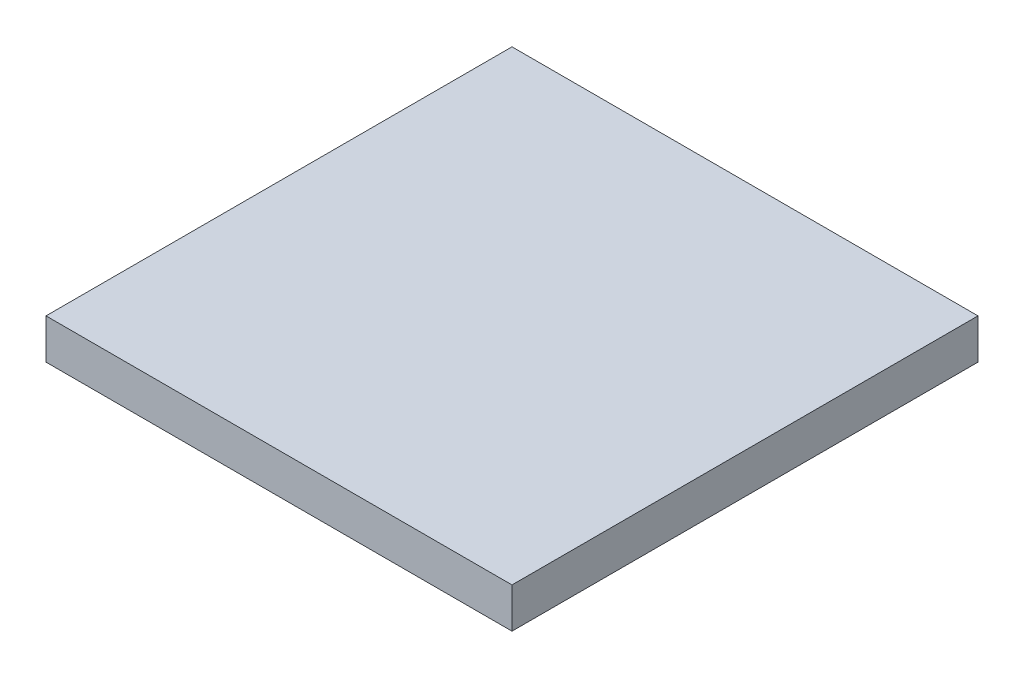
from build123d import *

# Parameters (mm, degrees)
SKIZZE1_W                       = 3000
SKIZZE1_H                       = 3000
AUFSATZ_LINEAR_AUSTRAGEN1_DEPTH = 258


with BuildPart() as part:
    # Skizze1 → Aufsatz-Linear austragen1 (new body)
    with BuildSketch(Plane(origin=(0, 0, 0), x_dir=(1, 0, 0), z_dir=(0, 1, 0))):
        with Locations((455.462294315, -1047.275658361)):
            Rectangle(SKIZZE1_W, SKIZZE1_H)
    extrude(amount=AUFSATZ_LINEAR_AUSTRAGEN1_DEPTH)


solid = part.part
